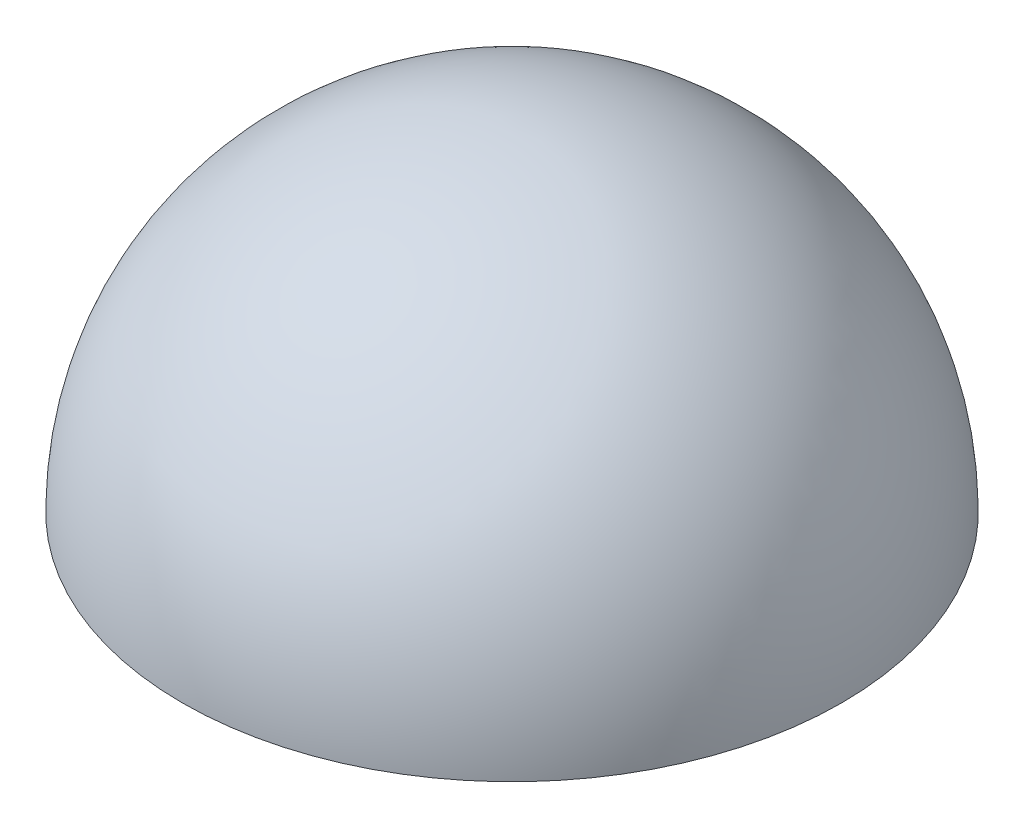
from build123d import *


with BuildPart() as part:
    # Sketch1 → Revolve1 (revolve)
    with BuildSketch(Plane.XY):
        with BuildLine():
            Line((0, 2.7), (0, 0.15))
            Line((0, 0.15), (1.5, 0.15))
            Line((1.5, 0.15), (1.5, 0))
            Line((1.5, 0), (2.7, 0))
            ThreePointArc((2.7, 0), (1.909188309, 1.909188309), (0, 2.7))
        make_face()
    revolve(axis=Axis((0, 2.7, 0), (0, -1, 0)))


solid = part.part
